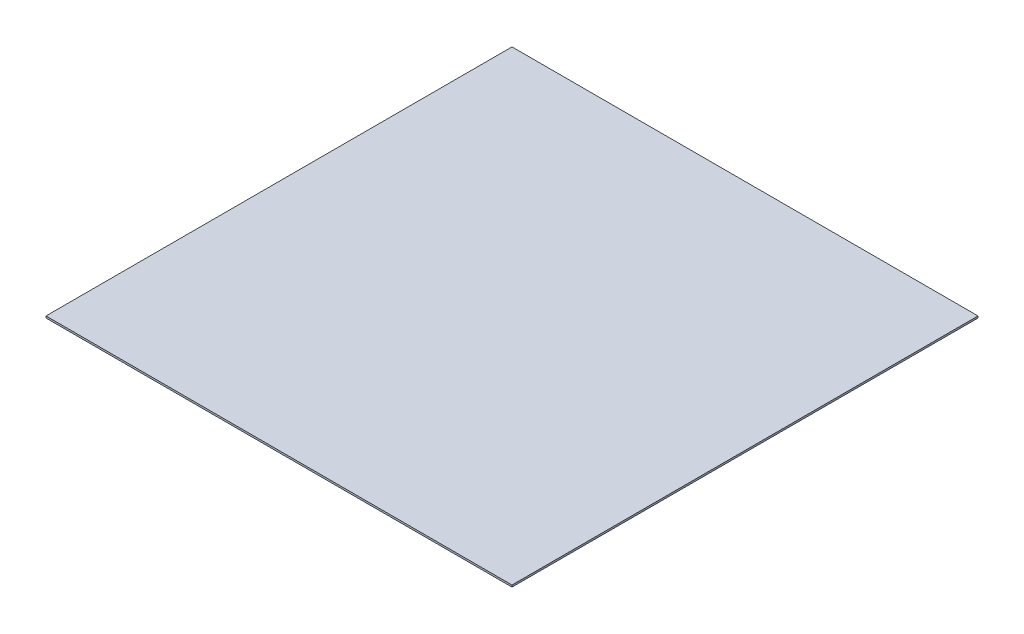
from build123d import *

# Parameters (mm, degrees)
SKETCH1_W           = 504
SKETCH1_H           = 504
BOSS_EXTRUDE1_DEPTH = 1


with BuildPart() as part:
    # Sketch1 → Boss-Extrude1 (new, symmetric)
    with BuildSketch(Plane(origin=(0, 0, 0), x_dir=(1, 0, 0), z_dir=(0, 1, 0))):
        Rectangle(SKETCH1_W, SKETCH1_H)
    extrude(amount=BOSS_EXTRUDE1_DEPTH, both=True)


solid = part.part
